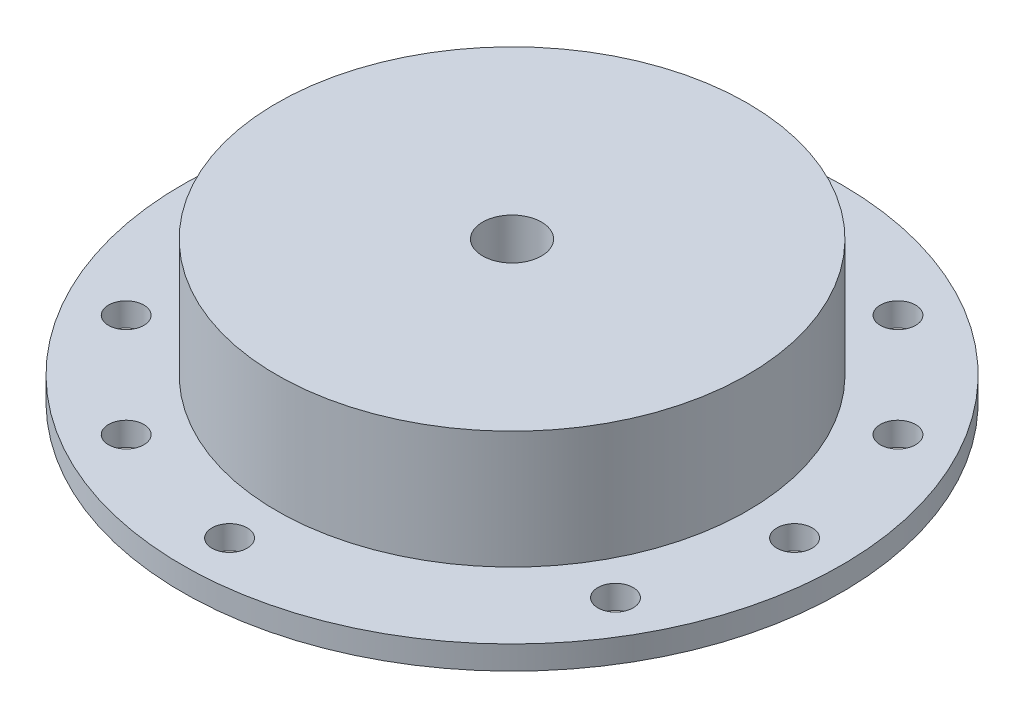
from build123d import *

# Parameters (mm, degrees)
F_3_8_0_375_DIAMETER_HOLE2_D = 9.525
CIRPATTERN2_COUNT            = 12


with BuildPart() as part:
    # Sketch1 → Revolve1 (revolve)
    with BuildSketch(Plane.XY, mode=Mode.PRIVATE) as revolve1_sk:
        with BuildLine():
            Line((7.9375, 38.1), (7.9375, 11.1125))
            ThreePointArc((7.9375, 11.1125), (22.02778747, 2.86649456), (38.1, 0))
            Line((38.1, 0), (88.9, 0))
            Line((88.9, 0), (88.9, 6.35))
            Line((88.9, 6.35), (63.5, 6.35))
            Line((63.5, 6.35), (63.5, 38.1))
            Line((63.5, 38.1), (7.9375, 38.1))
        make_face()
    revolve(revolve1_sk.sketch.rotate(Axis((0, 0, 0), (0, 1, 0)), 90), axis=Axis((0, 0, 0), (0, 1, 0)))

    # 3/8 (0.375) Diameter Hole2 (through all)
    with Locations(Plane(origin=(0, 6.35, 0), x_dir=(1, 0, 0), z_dir=(0, 1, 0))):
        with Locations((0, -76.2)):
            f_3_8_0_375_diameter_hole2 = Hole(F_3_8_0_375_DIAMETER_HOLE2_D / 2)

    # CirPattern2: 3/8 (0.375) Diameter Hole2 ×12 about axis, 1 skipped
    cirpattern2_axis = Axis((0, 0, 0), (0, 1, 0))
    add([f_3_8_0_375_diameter_hole2.rotate(cirpattern2_axis, i * 360 / CIRPATTERN2_COUNT) for i in range(1, CIRPATTERN2_COUNT) if i not in (1,)], mode=Mode.SUBTRACT)


solid = part.part
